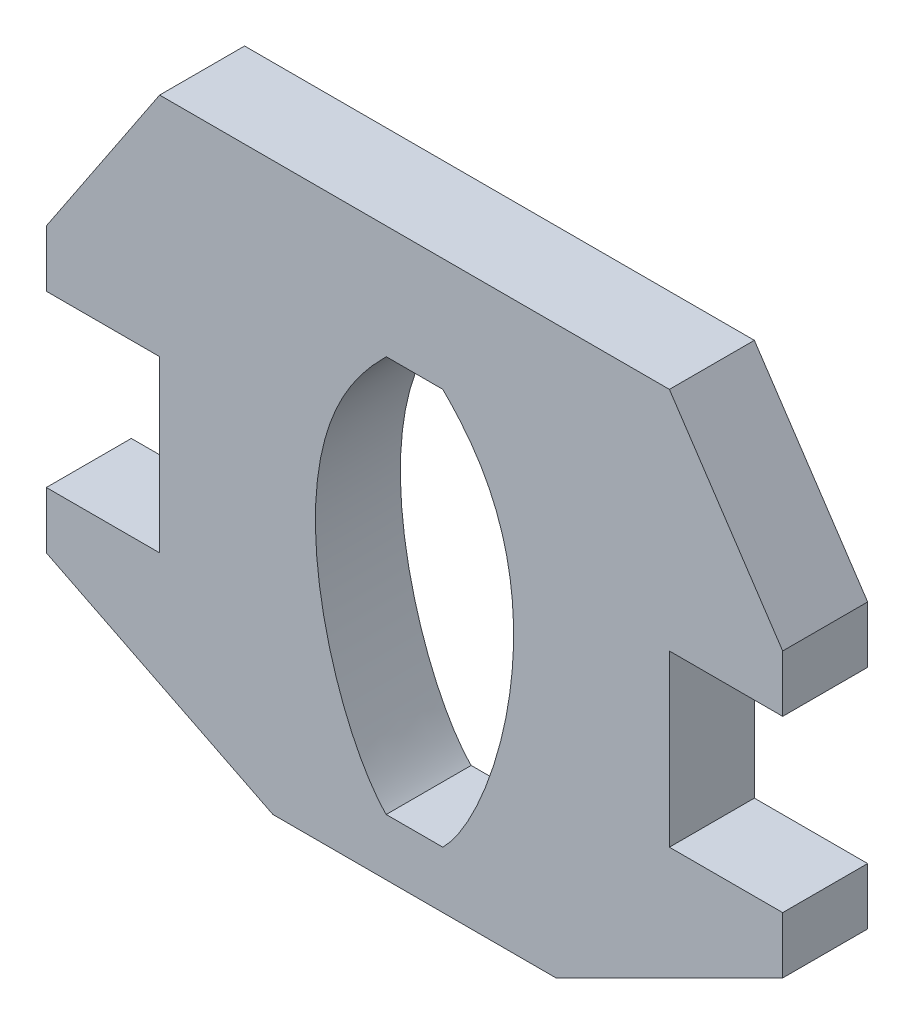
from build123d import *

# Parameters (mm, degrees)
BOSS_EXTRUDE1_DEPTH = 15


with BuildPart() as part:
    # Sketch1 → Boss-Extrude1 (new body)
    with BuildSketch(Plane.XY):
        Polygon((45, 50), (-45, 50), (-65, 20), (-65, 10), (-45, 10), (-45, -20), (-65, -20), (-65, -30), (-25, -50), (25, -50), (65, -30), (65, -20), (45, -20), (45, 10), (65, 10), (65, 20), align=None)
        with BuildLine():
            Line((-5, 30), (5, 30))
            add(Edge.make_bspline(
                [(5, 30), (15, 20), (25, 5), (15, -30), (5, -40)],
                knots=[0, 0, 0, 0, 0, 1, 1, 1, 1, 1], degree=4))
            Line((5, -40), (-5, -40))
            add(Edge.make_bspline(
                [(-5, 30), (-15, 20), (-25, 5), (-15, -30), (-5, -40)],
                knots=[0, 0, 0, 0, 0, 1, 1, 1, 1, 1], degree=4))
        make_face(mode=Mode.SUBTRACT)
    extrude(amount=BOSS_EXTRUDE1_DEPTH)


solid = part.part
